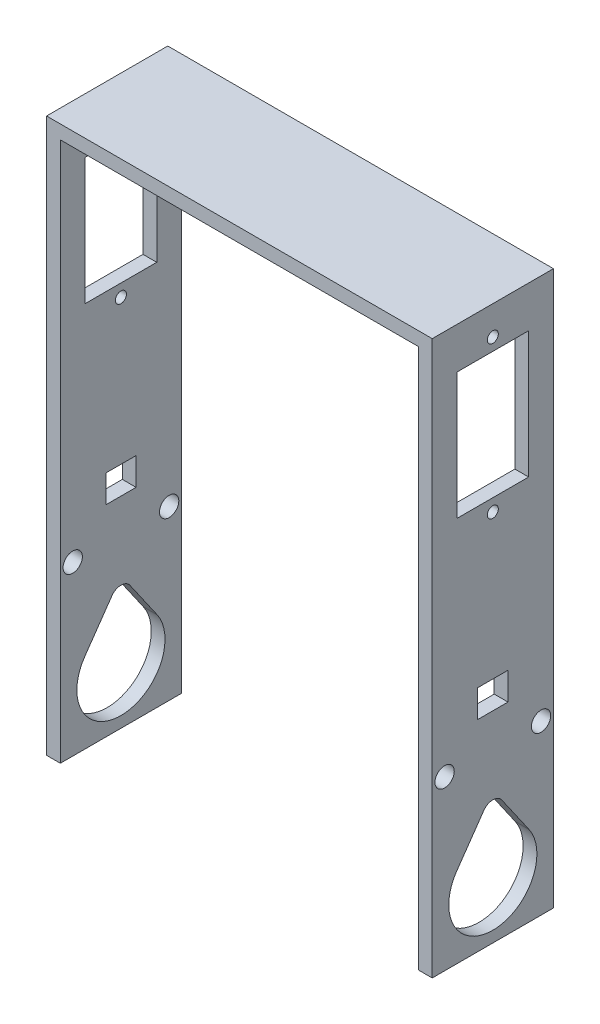
from build123d import *

# Parameters (mm, degrees)
CROQUIS1_W                 = 22
CROQUIS1_H                 = 100.5
CROQUIS1_R                 = 1.75
CROQUIS1_R_2               = 1
CROQUIS1_W_2               = 13
CROQUIS1_H_2               = 23
CROQUIS1_W_3               = 5.5
CROQUIS1_H_3               = 5
SALIENTE_EXTRUIR1_DEPTH    = 35
CORTAR_EXTRUIR2_DEPTH      = 100.494974747
CORTAR_EXTRUIR2_DEPTH_BACK = 100.494974747


with BuildPart() as part:
    # Croquis1 → Saliente-Extruir1 (new, symmetric)
    with BuildSketch(Plane(origin=(0, 0, 0), x_dir=(0, 0, -1), z_dir=(1, 0, 0))):
        with Locations((0, 40.25)):
            Rectangle(CROQUIS1_W, CROQUIS1_H)
        with Locations((-8.75, 20.5)):
            Circle(CROQUIS1_R, mode=Mode.SUBTRACT)
        with Locations((8.75, 20.5)):
            Circle(CROQUIS1_R, mode=Mode.SUBTRACT)
        with Locations((0, 85.25)):
            Circle(CROQUIS1_R_2, mode=Mode.SUBTRACT)
        with Locations((0, 57.75)):
            Circle(CROQUIS1_R_2, mode=Mode.SUBTRACT)
        with BuildLine():
            Line((-6.565214453, 4.571428571), (-1.641303613, 11.642857143))
            ThreePointArc((-1.641303613, 11.642857143), (0, 12.5), (1.641303613, 11.642857143))
            Line((1.641303613, 11.642857143), (6.565214453, 4.571428571))
            ThreePointArc((6.565214453, 4.571428571), (0, -8), (-6.565214453, 4.571428571))
        make_face(mode=Mode.SUBTRACT)
        with Locations((0, 71.5)):
            Rectangle(CROQUIS1_W_2, CROQUIS1_H_2, mode=Mode.SUBTRACT)
        with Locations((0, 29)):
            Rectangle(CROQUIS1_W_3, CROQUIS1_H_3, mode=Mode.SUBTRACT)
    extrude(amount=SALIENTE_EXTRUIR1_DEPTH, both=True)

    # Croquis2 → Cortar-Extruir2 (cut, two sides: drawn at the far end of the back side and taken through both)
    with BuildSketch(Plane.XY.offset(11).offset(-CORTAR_EXTRUIR2_DEPTH_BACK)):
        Polygon((32.5, -262.128065288), (32.5, -10), (32.5, 88), (-32.5, 88), (-32.5, -10), (-32.5, -262.128065288), (-32.5, -766.384195863), (32.5, -766.384195863), align=None)
    extrude(amount=CORTAR_EXTRUIR2_DEPTH + CORTAR_EXTRUIR2_DEPTH_BACK, mode=Mode.SUBTRACT)


solid = part.part
